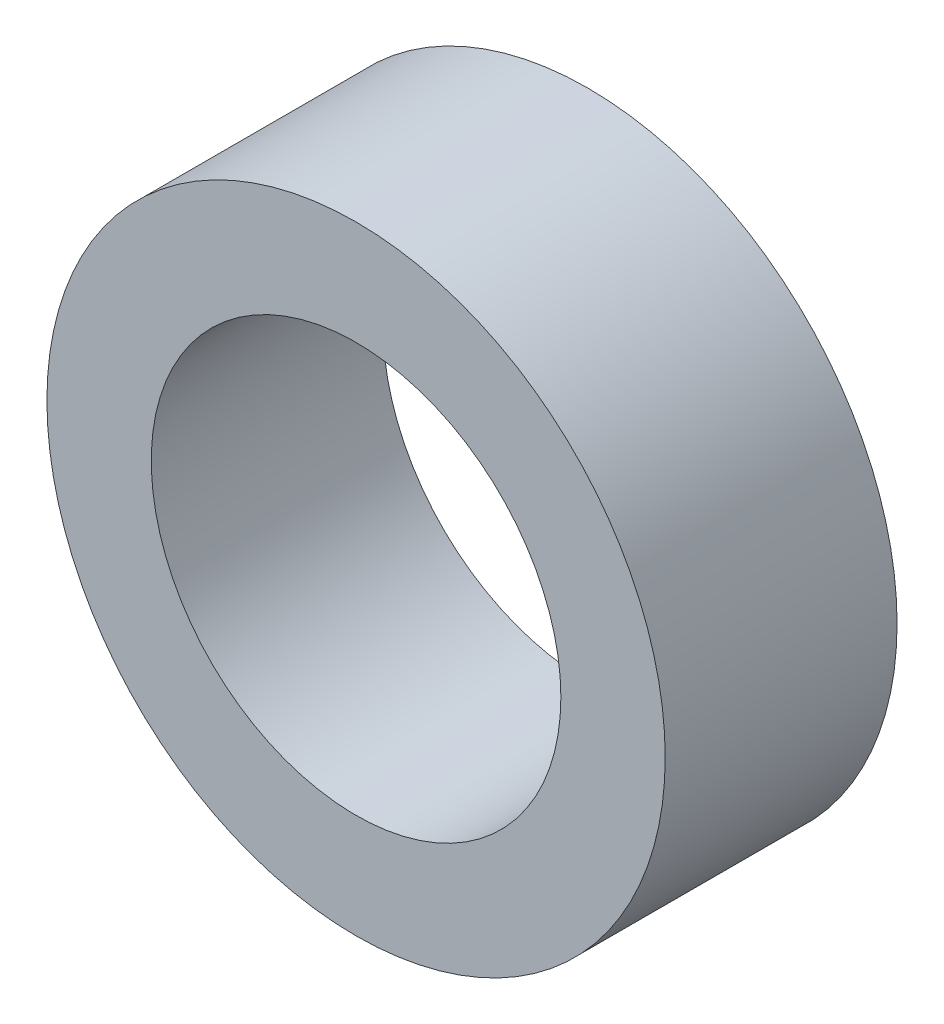
from build123d import *

# Parameters (mm, degrees)
SKETCH1_R      = 4
SKETCH1_R_2    = 2.65
EXTRUDE1_DEPTH = 1.5


with BuildPart() as part:
    # Sketch1 → Extrude1 (new, symmetric)
    with BuildSketch(Plane.XY):
        Circle(SKETCH1_R)
        Circle(SKETCH1_R_2, mode=Mode.SUBTRACT)
    extrude(amount=EXTRUDE1_DEPTH, both=True)


solid = part.part
